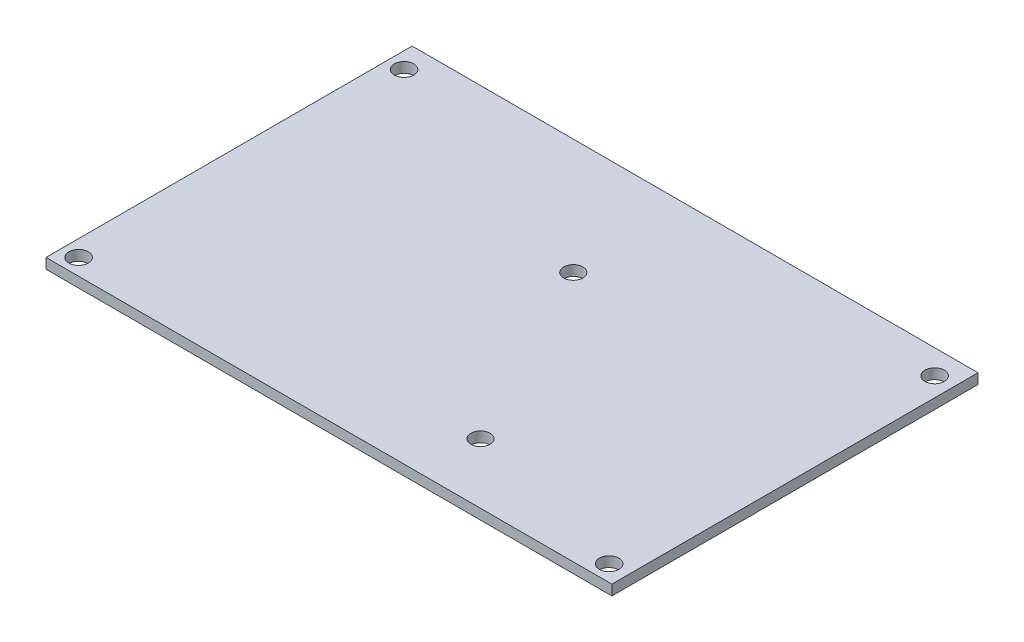
from build123d import *

# Parameters (mm, degrees)
SKICA2_W                = 88.316
SKICA2_H                = 57.14
SKICA2_R                = 1.524
SKICA2_R_2              = 1.5
P_IDAT_VYSUNUT_M1_DEPTH = 1.6


with BuildPart() as part:
    # Skica2 → Přidat vysunutím1 (new body)
    with BuildSketch(Plane(origin=(0, 0, 0), x_dir=(1, 0, 0), z_dir=(0, 1, 0))):
        with Locations((45.682, 37.206)):
            Rectangle(SKICA2_W, SKICA2_H)
        with Locations(Location((4.064, 61.976, 0), (0, 0, 270))):
            Circle(SKICA2_R, mode=Mode.SUBTRACT)
        with Locations(Location((4.064, 11.176, 0), (0, 0, 270))):
            Circle(SKICA2_R, mode=Mode.SUBTRACT)
        with Locations(Location((86.868, 11.176, 0), (0, 0, 270))):
            Circle(SKICA2_R, mode=Mode.SUBTRACT)
        with Locations(Location((86.868, 61.976, 0), (0, 0, 270))):
            Circle(SKICA2_R, mode=Mode.SUBTRACT)
        with Locations(Location((59.944, 18.034, 0), (0, 0, 270))):
            Circle(SKICA2_R_2, mode=Mode.SUBTRACT)
        with Locations(Location((44.704, 47.752, 0), (0, 0, 270))):
            Circle(SKICA2_R_2, mode=Mode.SUBTRACT)
    extrude(amount=P_IDAT_VYSUNUT_M1_DEPTH)


solid = part.part
